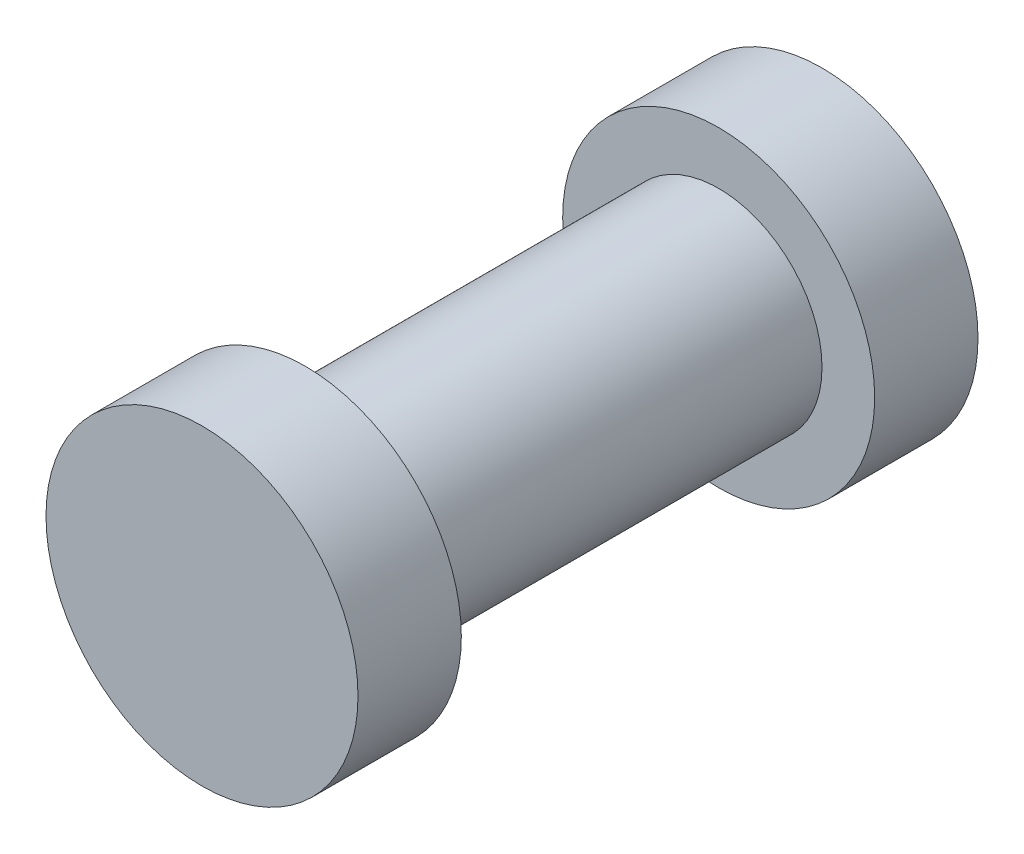
from build123d import *

# Parameters (mm, degrees)
SKETCH2_R           = 5
BOSS_EXTRUDE1_DEPTH = 10
SKETCH3_R           = 7.548336158
BOSS_EXTRUDE2_DEPTH = 5
BOSS_EXTRUDE3_START = 5
SKETCH4_R           = 7.548336158
BOSS_EXTRUDE3_DEPTH = 5


with BuildPart() as part:
    # Sketch2 → Boss-Extrude1 (new, symmetric)
    with BuildSketch(Plane.XY):
        Circle(SKETCH2_R)
    extrude(amount=BOSS_EXTRUDE1_DEPTH, both=True)

    # Sketch3 → Boss-Extrude2 (add)
    with BuildSketch(Plane.XY.offset(10)):
        Circle(SKETCH3_R)
    extrude(amount=BOSS_EXTRUDE2_DEPTH)

    # Sketch4 → Boss-Extrude3 (add)
    with BuildSketch(Plane(origin=(0, 0, -10), x_dir=(-1, 0, 0), z_dir=(0, 0, -1)).offset(BOSS_EXTRUDE3_START)):
        with Locations(Location((0, 0, 0), (0, 0, 180))):
            Circle(SKETCH4_R)
    extrude(amount=-BOSS_EXTRUDE3_DEPTH)


solid = part.part
